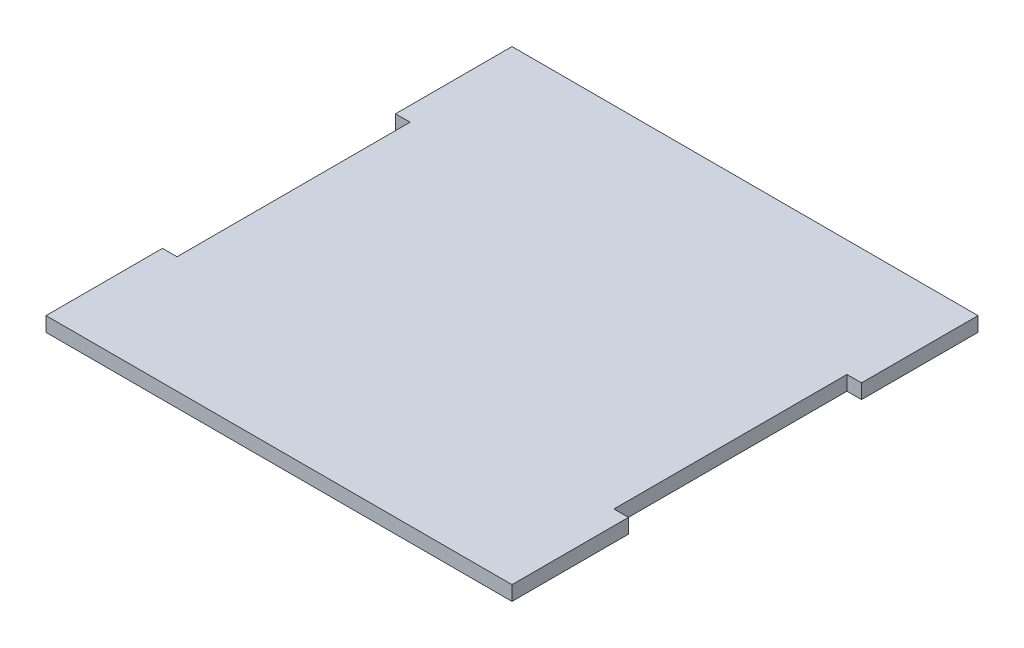
from build123d import *

# Parameters (mm, degrees)
BOSS_EXTRUDE1_DEPTH = 3.175


with BuildPart() as part:
    # Sketch1 → Boss-Extrude1 (new body)
    with BuildSketch(Plane(origin=(0, 0, 0), x_dir=(1, 0, 0), z_dir=(0, 1, 0))):
        Polygon((0, 0), (101.6, 0), (101.6, 25.4), (98.425, 25.4), (98.425, 76.2), (101.6, 76.2), (101.6, 101.6), (0, 101.6), (0, 76.2), (3.175, 76.2), (3.175, 25.4), (0, 25.4), align=None)
    extrude(amount=BOSS_EXTRUDE1_DEPTH)


solid = part.part
